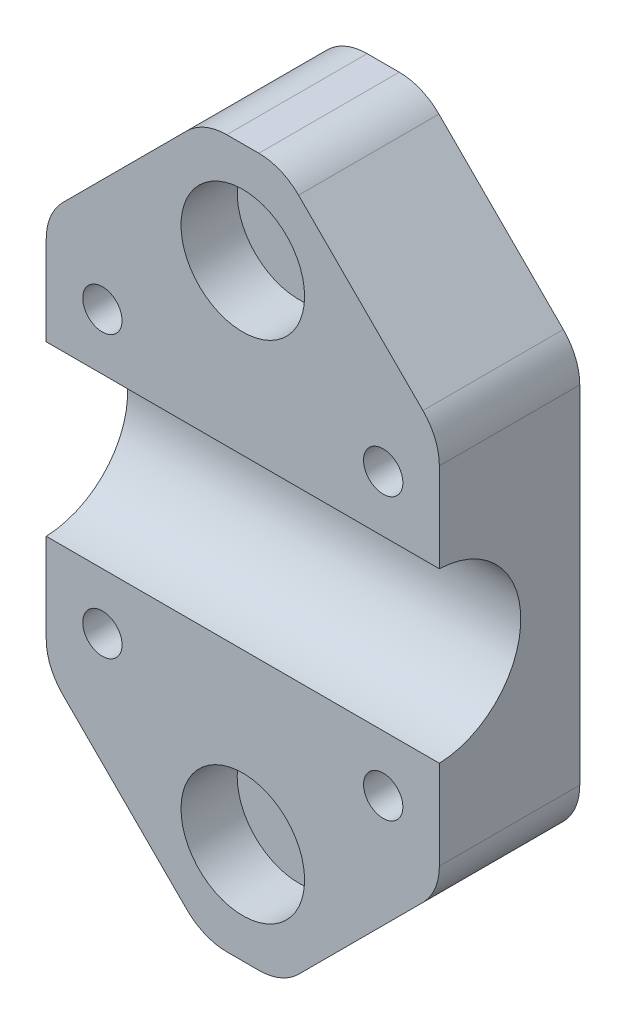
from build123d import *

# Parameters (mm, degrees)
BOSS_EXTRUDE1_DEPTH = 12.5
CUT_EXTRUDE1_REACH  = 50.719
SKETCH3_R           = 3
CUT_EXTRUDE2_DEPTH  = 3
SKETCH4_R           = 5.5
CUT_EXTRUDE3_DEPTH  = 5
FILLET1_R           = 5
SKETCH5_R           = 1.75
CUT_EXTRUDE4_DEPTH  = 9.1


with BuildPart() as part:
    # Sketch1 → Boss-Extrude1 (new body)
    with BuildSketch(Plane.XY):
        Polygon((-3.5, 31.5), (-17.5, 17.5), (-17.5, -17.5), (-3.5, -31.5), (3.5, -31.5), (17.5, -17.5), (17.5, 17.5), (3.5, 31.5), align=None)
    extrude(amount=BOSS_EXTRUDE1_DEPTH)

    # Sketch2 → Cut-Extrude1 (cut, up to next)
    with BuildSketch(Plane(origin=(17.5, 0, 0), x_dir=(0, 0, -1), z_dir=(1, 0, 0)), mode=Mode.PRIVATE) as cut_extrude1_sk1:
        with BuildLine():
            Line((-12.5, -7.495832175), (-12.5, 7.495832175))
            ThreePointArc((-12.5, 7.495832175), (-5.25, 0), (-12.5, -7.495832175))
        make_face()
    cut_extrude1_tool1 = extrude(cut_extrude1_sk1.sketch, amount=-CUT_EXTRUDE1_REACH, mode=Mode.PRIVATE) & part.part
    add(cut_extrude1_tool1.solids().sort_by_distance((17.5, 0, 9.431384))[0], mode=Mode.SUBTRACT)

    # Sketch3 → Cut-Extrude2 (cut)
    with BuildSketch(Plane(origin=(0, 0, 0), x_dir=(-1, 0, 0), z_dir=(0, 0, -1))):
        with Locations((-12.5, 12.5)):
            Circle(SKETCH3_R)
        with Locations(Location((12.5, 12.5, 0), (0, 0, 180))):
            Circle(SKETCH3_R)
        with Locations((12.5, -12.5)):
            Circle(SKETCH3_R)
        with Locations(Location((-12.5, -12.5, 0), (0, 0, 180))):
            Circle(SKETCH3_R)
    extrude(amount=-CUT_EXTRUDE2_DEPTH, mode=Mode.SUBTRACT)

    # Sketch4 → Cut-Extrude3 (cut)
    with BuildSketch(Plane.XY.offset(12.5)):
        with Locations((0, 22.5)):
            Circle(SKETCH4_R)
        with Locations(Location((0, -22.5, 0), (0, 0, 180))):
            Circle(SKETCH4_R)
    extrude(amount=-CUT_EXTRUDE3_DEPTH, mode=Mode.SUBTRACT)

    # Fillet1
    fillet1_edges = [part.edges().sort_by_distance(p)[0] for p in [
        (3.5, 31.5, 6.25),
        (17.5, 17.5, 6.25),
        (17.5, -17.5, 6.25),
        (3.5, -31.5, 6.25),
        (-3.5, -31.5, 6.25),
        (-17.5, -17.5, 6.25),
        (-17.5, 17.5, 6.25),
        (-3.5, 31.5, 6.25),
    ]]
    fillet(fillet1_edges, radius=FILLET1_R)

    # Sketch5 → Cut-Extrude4 (cut)
    with BuildSketch(Plane.XY.offset(12.5)):
        with Locations((-12.5, 12.5)):
            Circle(SKETCH5_R)
        with Locations(Location((12.5, 12.5, 0), (0, 0, 180))):
            Circle(SKETCH5_R)
        with Locations((12.5, -12.5)):
            Circle(SKETCH5_R)
        with Locations(Location((-12.5, -12.5, 0), (0, 0, 180))):
            Circle(SKETCH5_R)
    extrude(amount=-CUT_EXTRUDE4_DEPTH, mode=Mode.SUBTRACT)


solid = part.part
